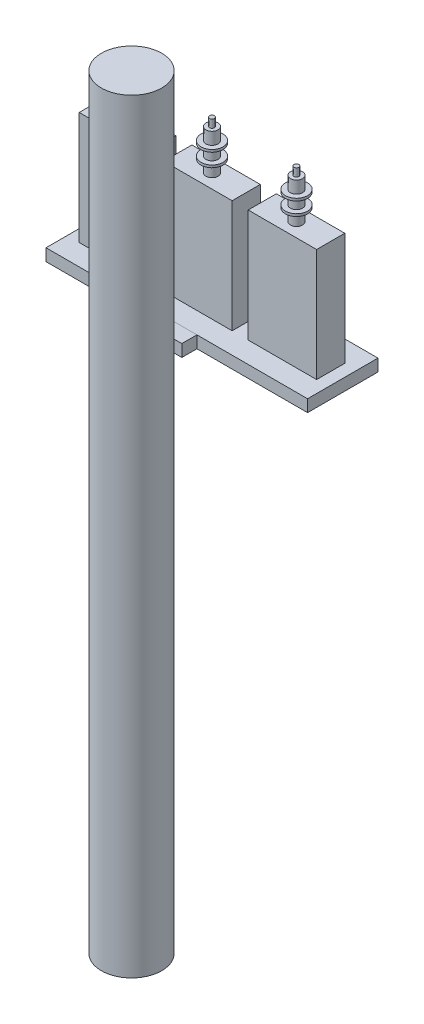
from build123d import *

# Parameters (mm, degrees)
RACK_START            = -60
SKETCH1_W             = 1300
SKETCH1_H             = 350
RACK_DEPTH            = 60
SKETCH2_W             = 200
SKETCH2_H             = 75
RACK_ARM_DEPTH        = 60
POLE_START            = -2600
SKETCH3_R             = 150
POLE_DEPTH            = 3800
SKETCH4_W             = 340
SKETCH4_H             = 140
CAPACITOR_CAN_A_DEPTH = 560
BUSHING_START         = 560
SKETCH5_R             = 30
BUSHING_A_DEPTH       = 200
SHED_START            = 620.666666667
SKETCH6_R             = 55
SHED_A_1_DEPTH        = 12
SHED_START_2          = 687.333333333
SKETCH7_R             = 55
SHED_A_2_DEPTH        = 12
TERMINAL_START        = 760
SKETCH8_R             = 12
TERMINAL_A_DEPTH      = 40
SKETCH9_W             = 340
SKETCH9_H             = 140
CAPACITOR_CAN_B_DEPTH = 560
SKETCH10_R            = 30
BUSHING_B_DEPTH       = 200
SKETCH11_R            = 55
SHED_B_1_DEPTH        = 12
SKETCH12_R            = 55
SHED_B_2_DEPTH        = 12
SKETCH13_R            = 12
TERMINAL_B_DEPTH      = 40
SKETCH14_W            = 340
SKETCH14_H            = 140
CAPACITOR_CAN_C_DEPTH = 560
SKETCH15_R            = 30
BUSHING_C_DEPTH       = 200
SKETCH16_R            = 55
SHED_C_1_DEPTH        = 12
SKETCH17_R            = 55
SHED_C_2_DEPTH        = 12
SKETCH18_R            = 12
TERMINAL_C_DEPTH      = 40


with BuildPart() as part:
    # Sketch1 → Rack (new body)
    with BuildSketch(Plane(origin=(0, 0, 0), x_dir=(1, 0, 0), z_dir=(0, 1, 0)).offset(RACK_START)):
        Rectangle(SKETCH1_W, SKETCH1_H)
    extrude(amount=RACK_DEPTH)


with BuildPart() as body_2:
    # Sketch2 → Rack arm (new body)
    with BuildSketch(Plane(origin=(0, 0, 0), x_dir=(1, 0, 0), z_dir=(0, 1, 0)).offset(RACK_START)):
        with Locations((0, -212.5)):
            Rectangle(SKETCH2_W, SKETCH2_H)
    extrude(amount=RACK_ARM_DEPTH)


with BuildPart() as body_3:
    # Sketch3 → Pole (new body)
    with BuildSketch(Plane(origin=(0, 0, 0), x_dir=(1, 0, 0), z_dir=(0, 1, 0)).offset(POLE_START)):
        with Locations(Location((0, -400, 0), (0, 0, 90))):
            Circle(SKETCH3_R)
    extrude(amount=POLE_DEPTH)


with BuildPart() as body_4:
    # Sketch4 → Capacitor can A (new body)
    with BuildSketch(Plane(origin=(0, 0, 0), x_dir=(1, 0, 0), z_dir=(0, 1, 0))):
        with Locations((-420, 0)):
            Rectangle(SKETCH4_W, SKETCH4_H)
    extrude(amount=CAPACITOR_CAN_A_DEPTH)


with BuildPart() as body_5:
    # Sketch5 → Bushing A (new body)
    with BuildSketch(Plane(origin=(0, 0, 0), x_dir=(1, 0, 0), z_dir=(0, 1, 0)).offset(BUSHING_START)):
        with Locations(Location((-420, 0, 0), (0, 0, 270))):
            Circle(SKETCH5_R)
    extrude(amount=BUSHING_A_DEPTH)


with BuildPart() as body_6:
    # Sketch6 → Shed A 1 (new body)
    with BuildSketch(Plane(origin=(0, 0, 0), x_dir=(1, 0, 0), z_dir=(0, 1, 0)).offset(SHED_START)):
        with Locations(Location((-420, 0, 0), (0, 0, 270))):
            Circle(SKETCH6_R)
    extrude(amount=SHED_A_1_DEPTH)


with BuildPart() as body_7:
    # Sketch7 → Shed A 2 (new body)
    with BuildSketch(Plane(origin=(0, 0, 0), x_dir=(1, 0, 0), z_dir=(0, 1, 0)).offset(SHED_START_2)):
        with Locations(Location((-420, 0, 0), (0, 0, 270))):
            Circle(SKETCH7_R)
    extrude(amount=SHED_A_2_DEPTH)


with BuildPart() as body_8:
    # Sketch8 → Terminal A (new body)
    with BuildSketch(Plane(origin=(0, 0, 0), x_dir=(1, 0, 0), z_dir=(0, 1, 0)).offset(TERMINAL_START)):
        with Locations(Location((-420, 0, 0), (0, 0, 270))):
            Circle(SKETCH8_R)
    extrude(amount=TERMINAL_A_DEPTH)


with BuildPart() as body_9:
    # Sketch9 → Capacitor can B (new body)
    with BuildSketch(Plane(origin=(0, 0, 0), x_dir=(1, 0, 0), z_dir=(0, 1, 0))):
        Rectangle(SKETCH9_W, SKETCH9_H)
    extrude(amount=CAPACITOR_CAN_B_DEPTH)


with BuildPart() as body_10:
    # Sketch10 → Bushing B (new body)
    with BuildSketch(Plane(origin=(0, 0, 0), x_dir=(1, 0, 0), z_dir=(0, 1, 0)).offset(BUSHING_START)):
        with Locations(Location((0, 0, 0), (0, 0, 270))):
            Circle(SKETCH10_R)
    extrude(amount=BUSHING_B_DEPTH)


with BuildPart() as body_11:
    # Sketch11 → Shed B 1 (new body)
    with BuildSketch(Plane(origin=(0, 0, 0), x_dir=(1, 0, 0), z_dir=(0, 1, 0)).offset(SHED_START)):
        with Locations(Location((0, 0, 0), (0, 0, 270))):
            Circle(SKETCH11_R)
    extrude(amount=SHED_B_1_DEPTH)


with BuildPart() as body_12:
    # Sketch12 → Shed B 2 (new body)
    with BuildSketch(Plane(origin=(0, 0, 0), x_dir=(1, 0, 0), z_dir=(0, 1, 0)).offset(SHED_START_2)):
        with Locations(Location((0, 0, 0), (0, 0, 270))):
            Circle(SKETCH12_R)
    extrude(amount=SHED_B_2_DEPTH)


with BuildPart() as body_13:
    # Sketch13 → Terminal B (new body)
    with BuildSketch(Plane(origin=(0, 0, 0), x_dir=(1, 0, 0), z_dir=(0, 1, 0)).offset(TERMINAL_START)):
        with Locations(Location((0, 0, 0), (0, 0, 270))):
            Circle(SKETCH13_R)
    extrude(amount=TERMINAL_B_DEPTH)


with BuildPart() as body_14:
    # Sketch14 → Capacitor can C (new body)
    with BuildSketch(Plane(origin=(0, 0, 0), x_dir=(1, 0, 0), z_dir=(0, 1, 0))):
        with Locations((420, 0)):
            Rectangle(SKETCH14_W, SKETCH14_H)
    extrude(amount=CAPACITOR_CAN_C_DEPTH)


with BuildPart() as body_15:
    # Sketch15 → Bushing C (new body)
    with BuildSketch(Plane(origin=(0, 0, 0), x_dir=(1, 0, 0), z_dir=(0, 1, 0)).offset(BUSHING_START)):
        with Locations(Location((420, 0, 0), (0, 0, 270))):
            Circle(SKETCH15_R)
    extrude(amount=BUSHING_C_DEPTH)


with BuildPart() as body_16:
    # Sketch16 → Shed C 1 (new body)
    with BuildSketch(Plane(origin=(0, 0, 0), x_dir=(1, 0, 0), z_dir=(0, 1, 0)).offset(SHED_START)):
        with Locations(Location((420, 0, 0), (0, 0, 270))):
            Circle(SKETCH16_R)
    extrude(amount=SHED_C_1_DEPTH)


with BuildPart() as body_17:
    # Sketch17 → Shed C 2 (new body)
    with BuildSketch(Plane(origin=(0, 0, 0), x_dir=(1, 0, 0), z_dir=(0, 1, 0)).offset(SHED_START_2)):
        with Locations(Location((420, 0, 0), (0, 0, 270))):
            Circle(SKETCH17_R)
    extrude(amount=SHED_C_2_DEPTH)


with BuildPart() as body_18:
    # Sketch18 → Terminal C (new body)
    with BuildSketch(Plane(origin=(0, 0, 0), x_dir=(1, 0, 0), z_dir=(0, 1, 0)).offset(TERMINAL_START)):
        with Locations(Location((420, 0, 0), (0, 0, 270))):
            Circle(SKETCH18_R)
    extrude(amount=TERMINAL_C_DEPTH)


solid = Compound([part.part, body_2.part, body_3.part, body_4.part, body_5.part, body_6.part, body_7.part, body_8.part, body_9.part, body_10.part, body_11.part, body_12.part, body_13.part, body_14.part, body_15.part, body_16.part, body_17.part, body_18.part])
